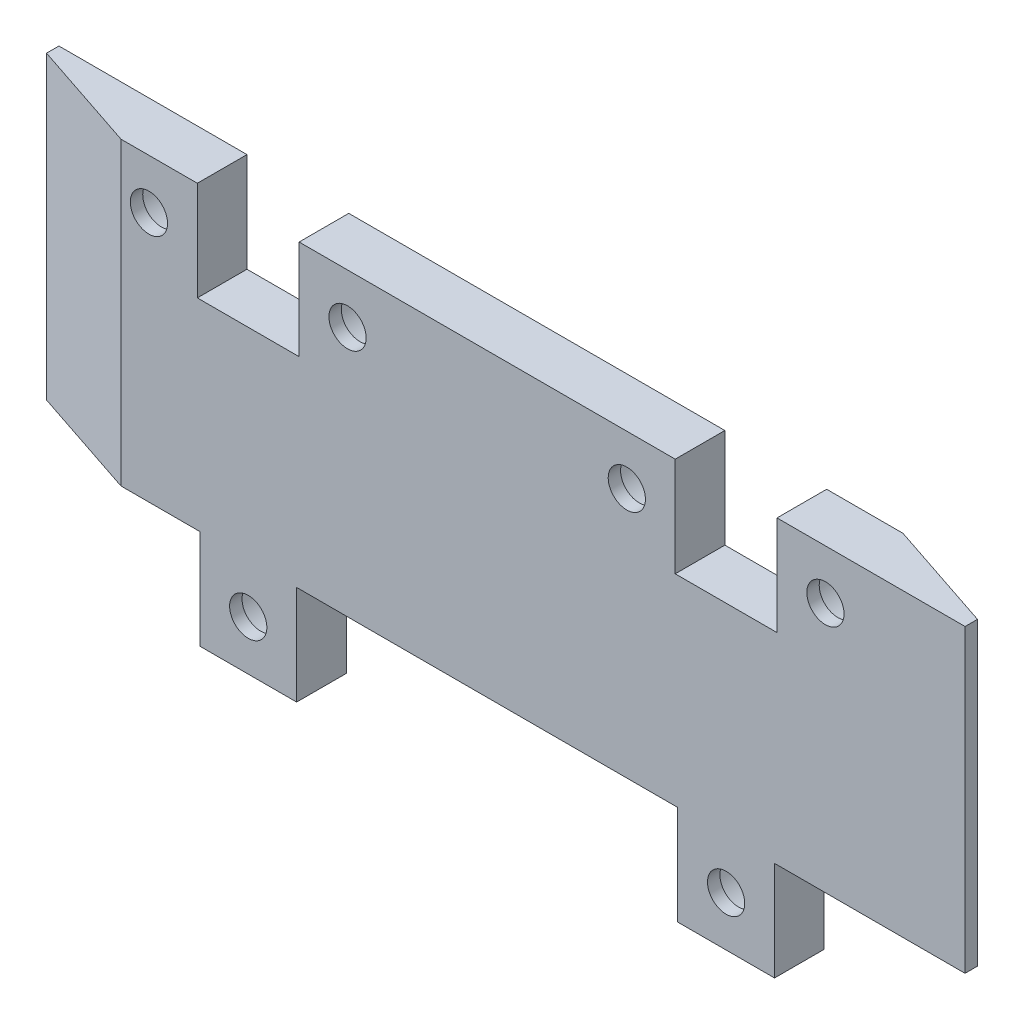
from build123d import *

# Parameters (mm, degrees)
SKETCH_1_W                       = 77
SKETCH_1_H                       = 32.2
EXTRUDE_1_DEPTH                  = 4
SKETCH_4_R                       = 1.5
CUT_EXTRUDE_3_DEPTH              = 42.92207056
SKETCH_9_R                       = 3
CUT_EXTRUDE_7_DEPTH              = 3
PATTERN_LINEAR_2_COUNT           = 2
PATTERN_LINEAR_2_PITCH           = 38.5
PATTERN_LINEAR_3_COUNT           = 2
PATTERN_LINEAR_3_PITCH           = 24.2
PATTERN_LINEAR_3_COPY_1_SKETCH_R = 1.5
PATTERN_LINEAR_3_COPY_1_DEPTH    = 42.92207056
PATTERN_LINEAR_3_COPY_2_SKETCH_R = 3
PATTERN_LINEAR_3_COPY_2_DEPTH    = 3
SKETCH_12_W                      = 8.2
SKETCH_12_H                      = 8
SKETCH_12_W_2                    = 15.35
CUT_EXTRUDE_13_DEPTH             = 10
PATTERN_LINEAR_5_COUNT           = 2
PATTERN_LINEAR_5_PITCH           = 38.5
CUT_EXTRUDE_14_DEPTH             = 51.349677258


with BuildPart() as part:
    # 草图1 → 凸台-拉伸1 (new body)
    with BuildSketch(Plane.XY):
        Rectangle(SKETCH_1_W, SKETCH_1_H)
    extrude(amount=EXTRUDE_1_DEPTH)

    # 草图4 → 切除-拉伸3 (cut, through all)
    with BuildSketch(Plane(origin=(0, 0, 0), x_dir=(-1, 0, 0), z_dir=(0, 0, -1))):
        with Locations((-27.25, 12.1)):
            Circle(SKETCH_4_R)
        with Locations((-19.25, 12.1)):
            Circle(SKETCH_4_R)
        with Locations((-11.25, 12.1)):
            Circle(SKETCH_4_R)
    cut_extrude_3 = extrude(amount=-CUT_EXTRUDE_3_DEPTH, mode=Mode.SUBTRACT)

    # 草图9 → 切除-拉伸7 (cut)
    with BuildSketch(Plane(origin=(0, 0, 0), x_dir=(-1, 0, 0), z_dir=(0, 0, -1))):
        with Locations((-27.25, 12.1)):
            Circle(SKETCH_9_R)
        with Locations((-19.25, 12.1)):
            Circle(SKETCH_9_R)
        with Locations((-11.25, 12.1)):
            Circle(SKETCH_9_R)
    cut_extrude_7 = extrude(amount=-CUT_EXTRUDE_7_DEPTH, mode=Mode.SUBTRACT)

    # 阵列(线性)2: 切除-拉伸3, 切除-拉伸7 ×2
    with Locations(*[(-i * PATTERN_LINEAR_2_PITCH, 0, 0) for i in range(1, PATTERN_LINEAR_2_COUNT)]):
        add(cut_extrude_3, mode=Mode.SUBTRACT)
        add(cut_extrude_7, mode=Mode.SUBTRACT)

    # 阵列(线性)3: 切除-拉伸3, 切除-拉伸7 ×2
    with Locations(*[(0, -i * PATTERN_LINEAR_3_PITCH, 0) for i in range(1, PATTERN_LINEAR_3_COUNT)]):
        add(cut_extrude_3, mode=Mode.SUBTRACT)
        add(cut_extrude_7, mode=Mode.SUBTRACT)

    # 阵列(线性)3 copy 1 sketch → 阵列(线性)3 copy 1 (cut, through all)
    with BuildSketch(Plane(origin=(-38.5, -24.2, 0), x_dir=(-1, 0, 0), z_dir=(0, 0, -1))):
        with Locations((-27.25, 12.1)):
            Circle(PATTERN_LINEAR_3_COPY_1_SKETCH_R)
        with Locations((-19.25, 12.1)):
            Circle(PATTERN_LINEAR_3_COPY_1_SKETCH_R)
        with Locations((-11.25, 12.1)):
            Circle(PATTERN_LINEAR_3_COPY_1_SKETCH_R)
    extrude(amount=-PATTERN_LINEAR_3_COPY_1_DEPTH, mode=Mode.SUBTRACT)

    # 阵列(线性)3 copy 2 sketch → 阵列(线性)3 copy 2 (cut)
    with BuildSketch(Plane(origin=(-38.5, -24.2, 0), x_dir=(-1, 0, 0), z_dir=(0, 0, -1))):
        with Locations((-27.25, 12.1)):
            Circle(PATTERN_LINEAR_3_COPY_2_SKETCH_R)
        with Locations((-19.25, 12.1)):
            Circle(PATTERN_LINEAR_3_COPY_2_SKETCH_R)
        with Locations((-11.25, 12.1)):
            Circle(PATTERN_LINEAR_3_COPY_2_SKETCH_R)
    extrude(amount=-PATTERN_LINEAR_3_COPY_2_DEPTH, mode=Mode.SUBTRACT)

    # 草图12 → 切除-拉伸13 (cut)
    with BuildSketch(Plane.XY):
        with Locations((-19.25, 12.1)):
            Rectangle(SKETCH_12_W, SKETCH_12_H)
        with Locations((-30.825, -12.1)):
            Rectangle(SKETCH_12_W_2, SKETCH_12_H)
        with Locations((-7.675, -12.1)):
            Rectangle(SKETCH_12_W_2, SKETCH_12_H)
    cut_extrude_13 = extrude(amount=CUT_EXTRUDE_13_DEPTH, mode=Mode.SUBTRACT)

    # 阵列(线性)5: 切除-拉伸13 ×2
    with Locations(*[(i * PATTERN_LINEAR_5_PITCH, 0, 0) for i in range(1, PATTERN_LINEAR_5_COUNT)]):
        add(cut_extrude_13, mode=Mode.SUBTRACT)

    # 草图13 → 切除-拉伸14 (cut, through all)
    with BuildSketch(Plane(origin=(0, 16.1, 0), x_dir=(1, 0, 0), z_dir=(0, 1, 0))):
        Polygon((29.5, 0), (38.5, 0), (38.5, -3), align=None)
        Polygon((-38.5, -1), (-38.5, -4), (-29.5, -4), align=None)
    extrude(amount=-CUT_EXTRUDE_14_DEPTH, mode=Mode.SUBTRACT)


solid = part.part
